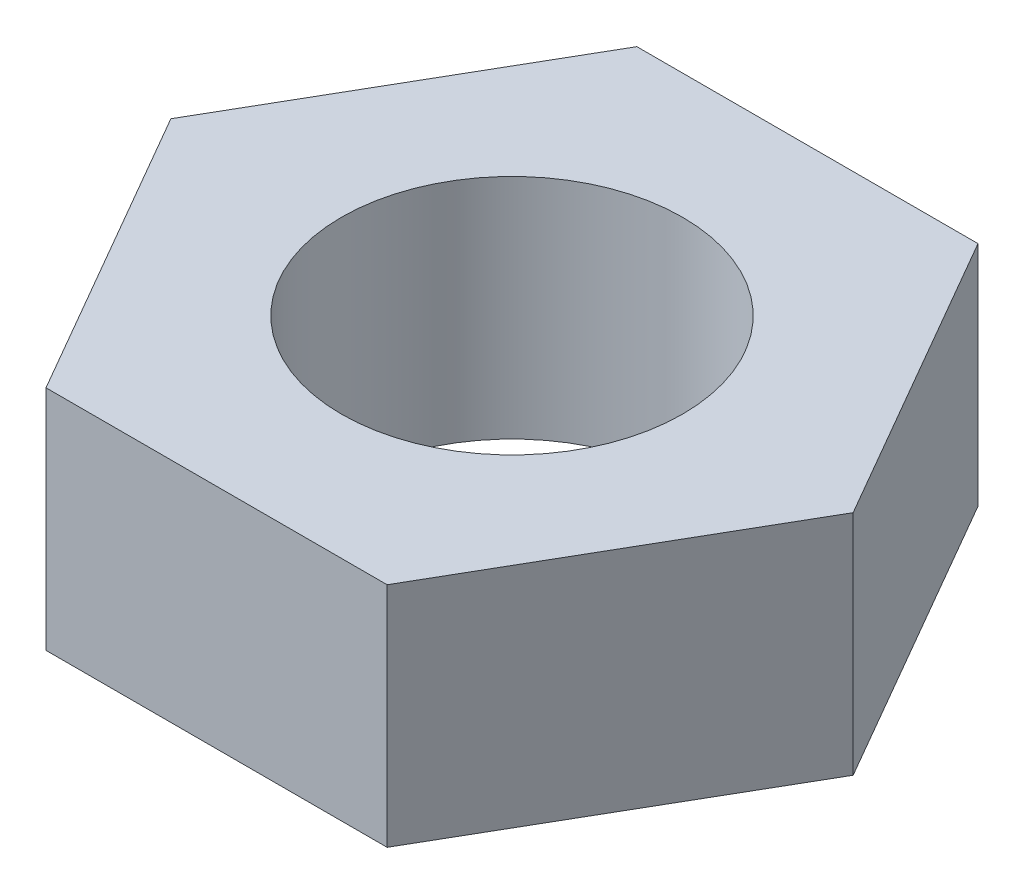
from build123d import *

# Parameters (mm, degrees)
SKETCH1_R           = 1.5
BOSS_EXTRUDE1_DEPTH = 2


with BuildPart() as part:
    # Sketch1 → Boss-Extrude1 (new body)
    with BuildSketch(Plane(origin=(0, 0, 0), x_dir=(1, 0, 0), z_dir=(0, 1, 0))):
        Polygon((3, 0), (1.5, 2.598076211), (-1.5, 2.598076211), (-3, 0), (-1.5, -2.598076211), (1.5, -2.598076211), align=None)
        with Locations(Location((0, 0, 0), (0, 0, 270))):
            Circle(SKETCH1_R, mode=Mode.SUBTRACT)
    extrude(amount=BOSS_EXTRUDE1_DEPTH)


solid = part.part
